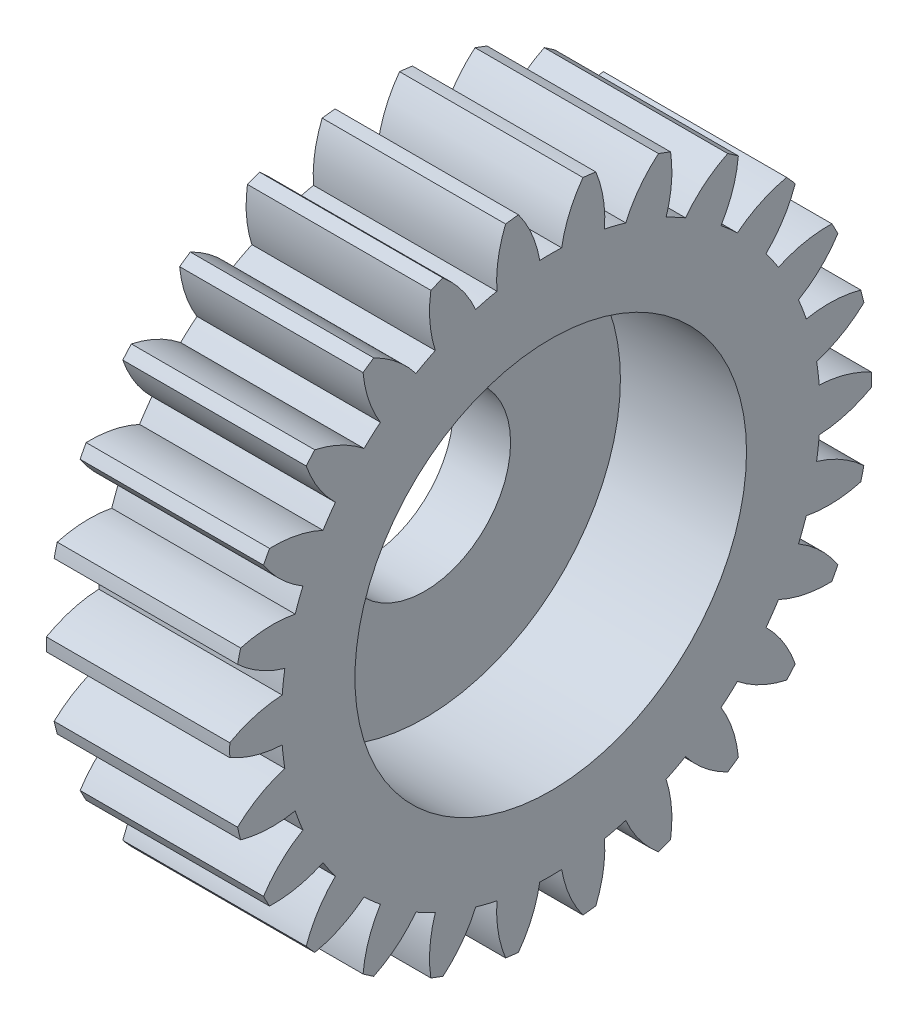
from build123d import *

# Parameters (mm, degrees)
BASPROSKE_W        = 10
BASPROSKE_H        = 14
TOOTHCUT_DEPTH     = 23.181073013
TEETHCUTS_COUNT    = 26
TEETHCUTS_ANGLE    = 346.153846154
BORSKE_R           = 0.4
BORE_DEPTH         = 50.0000508
SKETCH1_R          = 8.54
CUT_EXTRUDE1_DEPTH = 5.5
SKETCH2_R          = 3.75
CUT_EXTRUDE2_DEPTH = 21.500522978
SKETCH3_R          = 15.294835459
CUT_EXTRUDE3_DEPTH = 2


with BuildPart() as part:
    # BasProSke → Base-Revolve (revolve)
    with BuildSketch(Plane(origin=(0, 0, 0), x_dir=(1, 0, 0), z_dir=(0, 1, 0)), mode=Mode.PRIVATE) as base_revolve_sk:
        with Locations((5, 7)):
            Rectangle(BASPROSKE_W, BASPROSKE_H)
    revolve(base_revolve_sk.sketch.rotate(Axis((-10, 0, 0), (1, 0, 0)), 180), axis=Axis((-10, 0, 0), (1, 0, 0)))

    # TooCutSke → ToothCut (cut, through all)
    with BuildSketch(Plane(origin=(0, 0, 0), x_dir=(0, 0, -1), z_dir=(1, 0, 0))):
        with BuildLine():
            ThreePointArc((0.476965065, 11.739314517), (0, 11.749), (-0.476965065, 11.739314517))
            ThreePointArc((-0.476965065, 11.739314517), (-0.82065865, 12.901686978), (-1.424117301, 13.952911348))
            ThreePointArc((-1.424117301, 13.952911348), (0, 14.0254), (1.424117301, 13.952911348))
            ThreePointArc((1.424117301, 13.952911348), (0.82065865, 12.901686978), (0.476965065, 11.739314517))
        make_face()
    toothcut = extrude(amount=TOOTHCUT_DEPTH, mode=Mode.SUBTRACT)

    # TeethCuts: ToothCut ×26 about axis
    teethcuts_axis = Axis((-10, 0, 0), (1, 0, 0))
    for i in range(1, TEETHCUTS_COUNT):
        add(toothcut.rotate(teethcuts_axis, i * TEETHCUTS_ANGLE / (TEETHCUTS_COUNT - 1)), mode=Mode.SUBTRACT)

    # BorSke → Bore (cut, symmetric)
    with BuildSketch(Plane(origin=(0, 0, 0), x_dir=(0, 0, -1), z_dir=(1, 0, 0))):
        with Locations(Location((0, 0, 0), (0, 0, 180))):
            Circle(BORSKE_R)
    extrude(amount=BORE_DEPTH, both=True, mode=Mode.SUBTRACT)

    # Sketch1 → Cut-Extrude1 (cut)
    with BuildSketch(Plane(origin=(10, 0, 0), x_dir=(0, 0, -1), z_dir=(1, 0, 0))):
        Circle(SKETCH1_R)
    extrude(amount=-CUT_EXTRUDE1_DEPTH, mode=Mode.SUBTRACT)

    # Sketch2 → Cut-Extrude2 (cut, through all)
    with BuildSketch(Plane(origin=(4.5, 0, 0), x_dir=(0, 0, -1), z_dir=(1, 0, 0))):
        Circle(SKETCH2_R)
    extrude(amount=-CUT_EXTRUDE2_DEPTH, mode=Mode.SUBTRACT)

    # Sketch3 → Cut-Extrude3 (cut)
    with BuildSketch(Plane.ZY):
        Circle(SKETCH3_R)
    extrude(amount=-CUT_EXTRUDE3_DEPTH, mode=Mode.SUBTRACT)


solid = part.part
